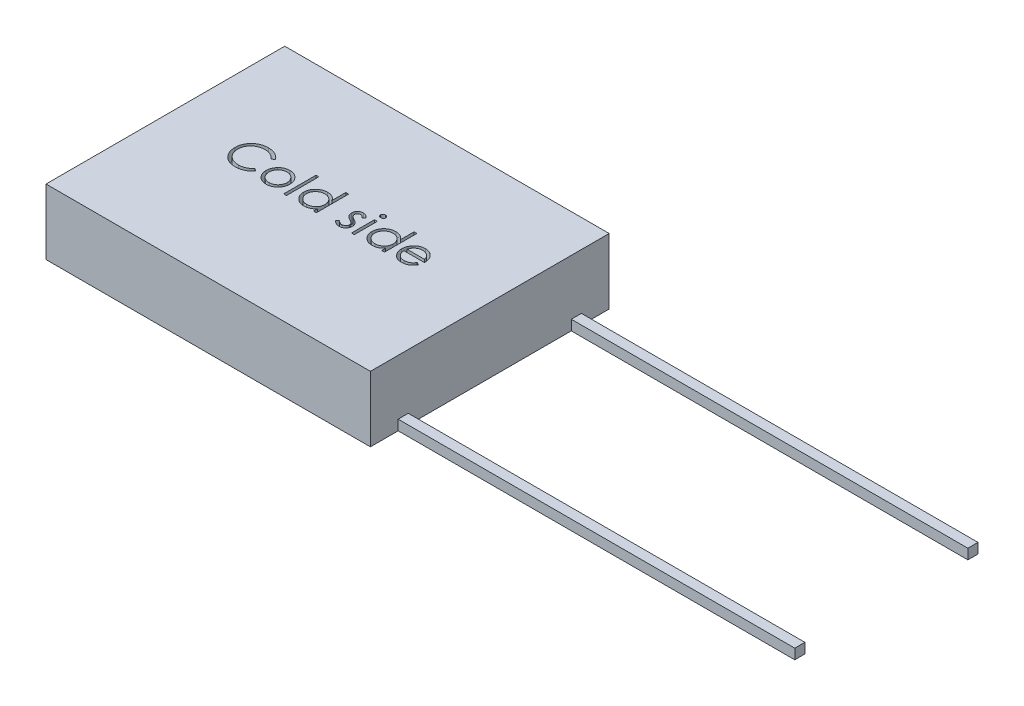
from build123d import *

# Parameters (mm, degrees)
BOSS_EXTRUDE1_DEPTH = 1.65
SKETCH2_3_W         = 10
SKETCH2_3_H         = 0.255
BOSS_EXTRUDE2_DEPTH = 0.255
SKETCH3_W           = 0.071233974
SKETCH3_H           = 0.814102564
SKETCH3_W_2         = 0.071233975
SKETCH3_H_2         = 0.580048077
CUT_EXTRUDE1_DEPTH  = 0.255


with BuildPart() as part:
    # Sketch2 → Boss-Extrude1 (new body)
    with BuildSketch(Plane(origin=(0, 0, 0), x_dir=(1, 0, 0), z_dir=(0, 1, 0))):
        Polygon((0, 6.02), (0, 0), (8.18, 0), (8.18, 0.7), (8.18, 0.955), (8.18, 5.065), (8.18, 5.32), (8.18, 6.02), align=None)
    extrude(amount=BOSS_EXTRUDE1_DEPTH)

    # Sketch2<3> → Boss-Extrude2 (add)
    with BuildSketch(Plane(origin=(0, 0, 0), x_dir=(1, 0, 0), z_dir=(0, 1, 0))):
        with Locations((13.18, 0.8275)):
            Rectangle(SKETCH2_3_W, SKETCH2_3_H)
        with Locations((13.18, 5.1925)):
            Rectangle(SKETCH2_3_W, SKETCH2_3_H)
    extrude(amount=BOSS_EXTRUDE2_DEPTH)

    # Sketch3 → Cut-Extrude1 (cut)
    # profile 1 of 9: a face of its own
    with BuildSketch(Plane(origin=(0, 1.65, 0), x_dir=(1, 0, 0), z_dir=(0, 1, 0))):
        with BuildLine():
            Line((2.356654302, 3.429735273), (2.294324575, 3.382033951))
            add(Edge.make_bspline(
                [(2.294324575, 3.382033951), (2.289878239, 3.387333019), (2.281045515, 3.397859713), (2.266835303, 3.412641502), (2.252025823, 3.426490231), (2.236622737, 3.439471872), (2.220348794, 3.45113246), (2.20359822, 3.462079656), (2.186090806, 3.471892161), (2.161881037, 3.483790017), (2.1302109, 3.496205663), (2.090343142, 3.50661586), (2.048725447, 3.513242805), (2.02033242, 3.513960546), (2.00589058, 3.514325618)],
                knots=[0, 0, 0, 0, 0.757959112, 1.505699292, 2.245454638, 2.979532153, 3.711538275, 4.438200793, 5.171680507, 5.909471876, 7.393775596, 8.890124382, 10.418191784, 12, 12, 12, 12], degree=3))
            add(Edge.make_bspline(
                [(2.00589058, 3.514325618), (1.997934189, 3.514234005), (1.98209525, 3.514051629), (1.958589257, 3.511645631), (1.93552219, 3.508263982), (1.912909054, 3.503246275), (1.890778633, 3.496902484), (1.868986249, 3.489322078), (1.847847416, 3.479943391), (1.827069709, 3.469577411), (1.807162638, 3.457869044), (1.788326939, 3.44509798), (1.770631311, 3.431407131), (1.754061754, 3.416745184), (1.73860133, 3.401178168), (1.724362065, 3.384540183), (1.711393231, 3.366884423), (1.699437763, 3.348443703), (1.688730589, 3.32927174), (1.679765777, 3.309297572), (1.671827116, 3.288863249), (1.665545323, 3.267737896), (1.660573156, 3.246070162), (1.657142418, 3.223801894), (1.654763783, 3.200979613), (1.654582314, 3.185510715), (1.654490841, 3.177713288)],
                knots=[0, 0, 0, 0, 1.054917814, 2.100044995, 3.131103042, 4.146048494, 5.169673617, 6.183595914, 7.203665975, 8.234915748, 9.262203917, 10.264457458, 11.251630812, 12.227803204, 13.197192746, 14.159520551, 15.12972552, 16.100847026, 17.073214652, 18.039054194, 19.002613845, 19.979014051, 20.95965708, 21.949030935, 22.966165397, 24, 24, 24, 24], degree=3))
            add(Edge.make_bspline(
                [(1.654490841, 3.177713288), (1.654777003, 3.165981364), (1.655338846, 3.142947287), (1.660339093, 3.109208237), (1.667937569, 3.076886585), (1.679325744, 3.04618437), (1.6933681, 3.016723011), (1.711111953, 2.989000985), (1.731662489, 2.962599371), (1.755310438, 2.938142131), (1.781256043, 2.915800626), (1.809093516, 2.896126833), (1.838753524, 2.879726851), (1.869908581, 2.866079806), (1.902798432, 2.855589441), (1.937363932, 2.848204363), (1.973529902, 2.84338694), (1.998242605, 2.842925728), (2.010819717, 2.842691002)],
                knots=[0, 0, 0, 0, 1.029171465, 2.020641659, 2.987623507, 3.938342917, 4.889210282, 5.84687017, 6.821220943, 7.821438502, 8.827599549, 9.822697543, 10.807740252, 11.797342354, 12.80366471, 13.83203677, 14.896651826, 16, 16, 16, 16], degree=3))
            add(Edge.make_bspline(
                [(2.010819717, 2.842691002), (2.024676934, 2.843073994), (2.051951252, 2.843827812), (2.091949001, 2.850213927), (2.13023854, 2.860568491), (2.166821931, 2.875059627), (2.201596038, 2.893897647), (2.23461528, 2.916734487), (2.26590753, 2.943787377), (2.284724231, 2.964443729), (2.294324575, 2.974982669)],
                knots=[0, 0, 0, 0, 1.028121516, 2.023589091, 2.998037872, 3.967518031, 4.937445131, 5.927275754, 6.942489185, 8, 8, 8, 8], degree=3))
            Line((2.294324575, 2.974982669), (2.356654302, 2.92775836))
            add(Edge.make_bspline(
                [(2.356654302, 2.92775836), (2.351638231, 2.921286247), (2.341630115, 2.908373022), (2.325424458, 2.890168545), (2.308352642, 2.873045308), (2.290287865, 2.857141365), (2.271437937, 2.842138478), (2.251464395, 2.828462884), (2.230629811, 2.815923701), (2.209004777, 2.804442238), (2.18661227, 2.794255648), (2.163479122, 2.785534883), (2.139705045, 2.778022631), (2.115288953, 2.771842281), (2.090180201, 2.767018303), (2.064469397, 2.763793484), (2.03810105, 2.761584157), (2.020311656, 2.76138279), (2.01129673, 2.761280746)],
                knots=[0, 0, 0, 0, 0.986787822, 1.968848986, 2.935600012, 3.899624008, 4.868462664, 5.837806735, 6.815139263, 7.798259679, 8.787526145, 9.778297419, 10.776456485, 11.791383307, 12.812564526, 13.85620153, 14.913611965, 16, 16, 16, 16], degree=3))
            add(Edge.make_bspline(
                [(2.01129673, 2.761280746), (2.002759684, 2.761340162), (1.985878733, 2.76145765), (1.960955266, 2.763360874), (1.936691558, 2.765957511), (1.913156955, 2.769867326), (1.890223029, 2.774481132), (1.868097682, 2.780665863), (1.846563197, 2.787593978), (1.825706091, 2.795736716), (1.805508623, 2.804925207), (1.786035937, 2.815310079), (1.767296989, 2.826804002), (1.749107546, 2.83915362), (1.731736308, 2.852755615), (1.715032741, 2.867421084), (1.698903179, 2.883100597), (1.688923999, 2.894406966), (1.683906656, 2.900091593)],
                knots=[0, 0, 0, 0, 1.114604814, 2.203992996, 3.262667896, 4.300477797, 5.318619304, 6.316056647, 7.298880507, 8.271930387, 9.238335007, 10.195173496, 11.151986948, 12.108099108, 13.064862484, 14.031167946, 15.010108607, 16, 16, 16, 16], degree=3))
            add(Edge.make_bspline(
                [(1.683906656, 2.900091593), (1.675870358, 2.909966113), (1.659894784, 2.929595938), (1.639455567, 2.961410795), (1.621959603, 2.994627692), (1.607813636, 3.02942114), (1.596754944, 3.065713066), (1.589093852, 3.103521763), (1.584115541, 3.142811921), (1.583546244, 3.169535621), (1.583256866, 3.183119438)],
                knots=[0, 0, 0, 0, 0.994628077, 1.977248131, 2.950237994, 3.925870899, 4.908910175, 5.911660606, 6.938484602, 8, 8, 8, 8], degree=3))
            add(Edge.make_bspline(
                [(1.583256866, 3.183119438), (1.583609562, 3.197396835), (1.584303469, 3.225486724), (1.590198944, 3.26671046), (1.599682849, 3.306205509), (1.613153215, 3.343898144), (1.630231393, 3.379986618), (1.6513285, 3.414195249), (1.676199441, 3.446742808), (1.704649158, 3.47713544), (1.735847464, 3.504925614), (1.769257267, 3.529374521), (1.804813172, 3.549721172), (1.842123471, 3.56672923), (1.881467545, 3.579802171), (1.922761452, 3.588953697), (1.965927599, 3.5946499), (1.995378542, 3.595369992), (2.010342704, 3.595735874)],
                knots=[0, 0, 0, 0, 1.032925535, 2.032216505, 3.007276963, 3.968222605, 4.92396291, 5.891752235, 6.871517503, 7.883894988, 8.900124299, 9.891468569, 10.874487609, 11.85992873, 12.854644235, 13.869047385, 14.917252991, 16, 16, 16, 16], degree=3))
            add(Edge.make_bspline(
                [(2.010342704, 3.595735874), (2.019462772, 3.595626532), (2.037515027, 3.595410101), (2.064219647, 3.593299601), (2.090218889, 3.589781336), (2.115530665, 3.584992513), (2.140278115, 3.579049067), (2.164272099, 3.571306535), (2.187653408, 3.562453608), (2.210274582, 3.55225767), (2.232027085, 3.540812534), (2.252904143, 3.528245062), (2.272739923, 3.514570835), (2.291674002, 3.49990615), (2.309389642, 3.483940763), (2.326389835, 3.467113808), (2.342097258, 3.448940601), (2.351793072, 3.436148768), (2.356654302, 3.429735273)],
                knots=[0, 0, 0, 0, 1.096760587, 2.17092713, 3.219439832, 4.250915756, 5.268269357, 6.278326846, 7.281116186, 8.274029601, 9.260640565, 10.235837813, 11.203064059, 12.156899882, 13.114053108, 14.069676657, 15.032185724, 16, 16, 16, 16], degree=3))
        make_face()
    # profile 2 of 9: a face of its own
    with BuildSketch(Plane(origin=(0, 1.65, 0), x_dir=(1, 0, 0), z_dir=(0, 1, 0))):
        with BuildLine():
            add(Edge.make_bspline(
                [(2.779288016, 3.371857669), (2.790171751, 3.371625919), (2.811512096, 3.371171513), (2.842764956, 3.366314905), (2.872597514, 3.35888827), (2.901124025, 3.348621327), (2.927979149, 3.334859527), (2.953554056, 3.318438135), (2.977778628, 3.298983868), (2.992298136, 3.283934806), (2.999668124, 3.276296021)],
                knots=[0, 0, 0, 0, 1.054011418, 2.066658804, 3.057071809, 4.030435133, 4.997543892, 5.974964718, 6.972108034, 8, 8, 8, 8], degree=3))
            add(Edge.make_bspline(
                [(2.999668124, 3.276296021), (3.006014032, 3.268990349), (3.018583036, 3.25452039), (3.034699726, 3.231058135), (3.048583901, 3.206760291), (3.05971068, 3.181304201), (3.06848389, 3.154912088), (3.074712718, 3.127493239), (3.078417701, 3.099108206), (3.078917303, 3.07983055), (3.079170328, 3.070067305)],
                knots=[0, 0, 0, 0, 1.025258237, 2.030674902, 3.01204498, 3.988269485, 4.97094183, 5.956517959, 6.965070386, 8, 8, 8, 8], degree=3))
            add(Edge.make_bspline(
                [(3.079170328, 3.070067305), (3.078947775, 3.06024747), (3.078507999, 3.040843019), (3.074347929, 3.012263627), (3.067877486, 2.984551587), (3.058617409, 2.957822919), (3.046743337, 2.931995921), (3.032253842, 2.907183398), (3.015047243, 2.883336396), (2.995542765, 2.860657408), (2.973986358, 2.839755427), (2.950601089, 2.821538123), (2.925846513, 2.805930385), (2.899393467, 2.793358197), (2.871483519, 2.783445462), (2.84205647, 2.776483137), (2.811158034, 2.772273612), (2.790060789, 2.771733052), (2.779288016, 2.771457028)],
                knots=[0, 0, 0, 0, 0.998656419, 1.973391657, 2.932242238, 3.890759089, 4.846373663, 5.82037756, 6.809684879, 7.83454468, 8.860553229, 9.859544525, 10.845671541, 11.83227036, 12.833544569, 13.85385346, 14.904124723, 16, 16, 16, 16], degree=3))
            add(Edge.make_bspline(
                [(2.779288016, 2.771457028), (2.768462464, 2.771733978), (2.747260072, 2.772276398), (2.716252573, 2.776466782), (2.686772784, 2.783442253), (2.658826299, 2.793390774), (2.632259521, 2.805930786), (2.607361512, 2.821490937), (2.583957245, 2.83976083), (2.562396277, 2.860655944), (2.542893022, 2.883336773), (2.525686108, 2.9071833), (2.511196695, 2.931995946), (2.499322602, 2.957822912), (2.49006253, 2.984551589), (2.483592086, 3.012263627), (2.479432016, 3.040843019), (2.47899224, 3.06024747), (2.478769687, 3.070067305)],
                knots=[0, 0, 0, 0, 1.099876186, 2.154163076, 3.173186993, 4.173200201, 5.163417411, 6.152872554, 7.150605724, 8.17532212, 9.198891216, 10.186952605, 11.159729845, 12.11414092, 13.071450619, 14.029093627, 15.002601286, 16, 16, 16, 16], degree=3))
            add(Edge.make_bspline(
                [(2.478769687, 3.070067305), (2.479024438, 3.079777486), (2.4795288, 3.099001975), (2.483230059, 3.127333648), (2.489434588, 3.154706091), (2.498218316, 3.180996333), (2.509447654, 3.20634087), (2.523136732, 3.230698751), (2.539417822, 3.254054913), (2.551936836, 3.26850617), (2.558271891, 3.275819007)],
                knots=[0, 0, 0, 0, 1.031353054, 2.041901799, 3.029428768, 4.008703097, 4.981709435, 5.96992636, 6.972712378, 8, 8, 8, 8], degree=3))
            add(Edge.make_bspline(
                [(2.558271891, 3.275819007), (2.565630767, 3.283524038), (2.580103294, 3.298677337), (2.604448452, 3.318074892), (2.629960443, 3.334838001), (2.657112346, 3.348326357), (2.685615423, 3.358948664), (2.715600858, 3.366334058), (2.74695977, 3.371154015), (2.768404541, 3.37162078), (2.779288016, 3.371857669)],
                knots=[0, 0, 0, 0, 1.027980169, 2.021703884, 2.998553061, 3.971491411, 4.943284454, 5.930300938, 6.949603206, 8, 8, 8, 8], degree=3))
        make_face()
        with BuildLine():
            add(Edge.make_bspline(
                [(2.778970007, 3.300623695), (2.771273442, 3.300404939), (2.756078997, 3.299973075), (2.733713484, 3.296688332), (2.712182413, 3.291484166), (2.691444936, 3.284090032), (2.671570984, 3.274542603), (2.652541531, 3.262815886), (2.634300602, 3.249065198), (2.617205027, 3.233312056), (2.601515467, 3.216103784), (2.587799926, 3.197768531), (2.576137447, 3.178603699), (2.566421911, 3.158589358), (2.559185816, 3.137522686), (2.553930506, 3.115642257), (2.550648862, 3.092903493), (2.550221058, 3.077445548), (2.550003661, 3.069590291)],
                knots=[0, 0, 0, 0, 1.021534396, 2.016698045, 2.994645724, 3.958388632, 4.93408049, 5.916473867, 6.921342795, 7.962252576, 8.998418191, 10.008913653, 10.997312074, 11.973003931, 12.956656626, 13.948281152, 14.957379055, 16, 16, 16, 16], degree=3))
            add(Edge.make_bspline(
                [(2.550003661, 3.069590291), (2.550368066, 3.059441171), (2.551091341, 3.039297065), (2.556973082, 3.009630971), (2.566812471, 2.981150801), (2.580099229, 2.954023513), (2.59674671, 2.928924622), (2.616360742, 2.906547338), (2.638730817, 2.887228413), (2.663590273, 2.871199007), (2.690431341, 2.858462777), (2.718837686, 2.849436938), (2.748465129, 2.843569608), (2.768712723, 2.842986434), (2.778970007, 2.842691002)],
                knots=[0, 0, 0, 0, 1.016792936, 2.018143844, 3.017858371, 4.030088057, 5.03801393, 6.028138512, 7.003788237, 7.991172063, 8.984598303, 9.972568034, 10.972917682, 12, 12, 12, 12], degree=3))
            add(Edge.make_bspline(
                [(2.778970007, 2.842691002), (2.789226702, 2.842988155), (2.809473132, 2.843574727), (2.839059409, 2.849407388), (2.867388114, 2.858502325), (2.894201303, 2.871184683), (2.919049444, 2.887289285), (2.941580405, 2.906438249), (2.961026965, 2.92898389), (2.977657979, 2.954056758), (2.99116233, 2.981108745), (3.000955663, 3.009636227), (3.006851544, 3.039295726), (3.007572911, 3.059440722), (3.007936354, 3.069590291)],
                knots=[0, 0, 0, 0, 1.02726834, 2.027799167, 3.010890988, 4.004497153, 4.992059811, 5.971914811, 6.958719428, 7.966827853, 8.981595046, 9.981490638, 10.983022906, 12, 12, 12, 12], degree=3))
            add(Edge.make_bspline(
                [(3.007936354, 3.069590291), (3.007719032, 3.077445595), (3.007291375, 3.092903632), (3.00400866, 3.115641724), (2.998757315, 3.13752464), (2.991506608, 3.158582148), (2.981833287, 3.178655519), (2.969945908, 3.197712261), (2.956286372, 3.216167299), (2.940407489, 3.233256428), (2.923329758, 3.249071339), (2.905081437, 3.262821218), (2.886080201, 3.274491065), (2.866263987, 3.284171695), (2.845523851, 3.291416895), (2.824022948, 3.296718382), (2.801752861, 3.299959194), (2.786612864, 3.300400778), (2.778970007, 3.300623695)],
                knots=[0, 0, 0, 0, 1.042956736, 2.052379634, 3.044323526, 4.02829302, 5.004299113, 5.996692471, 7.007513377, 8.048758398, 9.090003419, 10.095195979, 11.07790575, 12.047570684, 13.018257071, 13.989683339, 14.985167495, 16, 16, 16, 16], degree=3))
        make_face(mode=Mode.SUBTRACT)
    # profile 3 of 9: a face of its own
    with BuildSketch(Plane(origin=(0, 1.65, 0), x_dir=(1, 0, 0), z_dir=(0, 1, 0))):
        with Locations((3.247078982, 3.188684592)):
            Rectangle(SKETCH3_W, SKETCH3_H)
    # profile 4 of 9: a face of its own
    with BuildSketch(Plane(origin=(0, 1.65, 0), x_dir=(1, 0, 0), z_dir=(0, 1, 0))):
        with BuildLine():
            Line((4.035740841, 3.595735874), (4.035740841, 2.78163331))
            Line((4.035740841, 2.78163331), (3.964506866, 2.78163331))
            Line((3.964506866, 2.78163331), (3.964506866, 2.881965091))
            add(Edge.make_bspline(
                [(3.964506866, 2.881965091), (3.956474391, 2.872884683), (3.940798913, 2.855164153), (3.914618517, 2.832013374), (3.886867162, 2.812877577), (3.857679541, 2.797422149), (3.827082011, 2.785812522), (3.795142398, 2.777560661), (3.761847675, 2.772255273), (3.739111873, 2.771725497), (3.7275903, 2.771457028)],
                knots=[0, 0, 0, 0, 1.074387032, 2.096679803, 3.090159297, 4.057316773, 5.018401886, 5.985159533, 6.978961417, 8, 8, 8, 8], degree=3))
            add(Edge.make_bspline(
                [(3.7275903, 2.771457028), (3.717346853, 2.771735152), (3.697146323, 2.772283624), (3.6674308, 2.776538647), (3.638834879, 2.783371841), (3.611331539, 2.792874364), (3.585098748, 2.805479301), (3.559911905, 2.820569905), (3.535901491, 2.838540593), (3.513433481, 2.859084664), (3.492743367, 2.881399241), (3.474586614, 2.905199392), (3.459447969, 2.9303822), (3.446788772, 2.956628826), (3.437037816, 2.984141317), (3.430240224, 3.012824532), (3.425990158, 3.042644557), (3.425441912, 3.062950842), (3.425163918, 3.073247393)],
                knots=[0, 0, 0, 0, 1.033919861, 2.038935746, 3.024066025, 3.998881131, 4.97069526, 5.957263378, 6.95902576, 7.993208707, 9.027059324, 10.027763471, 11.009749337, 11.988697705, 12.965288445, 13.950418724, 14.960734635, 16, 16, 16, 16], degree=3))
            add(Edge.make_bspline(
                [(3.425163918, 3.073247393), (3.425448074, 3.083331125), (3.426009835, 3.103266121), (3.430194762, 3.132584683), (3.437232151, 3.160823646), (3.447108181, 3.187892095), (3.459772338, 3.213822785), (3.475177458, 3.238634055), (3.493324652, 3.262394258), (3.51424618, 3.284544697), (3.536909959, 3.305005443), (3.561155332, 3.322787495), (3.586379183, 3.338144709), (3.612972758, 3.350312551), (3.640542441, 3.360157115), (3.669333669, 3.366968163), (3.699226652, 3.370981663), (3.719521817, 3.371562861), (3.729816362, 3.371857669)],
                knots=[0, 0, 0, 0, 1.020392517, 2.01726096, 2.990465484, 3.961182959, 4.928053699, 5.906110375, 6.912531644, 7.948652711, 8.985773172, 9.998621852, 10.987621588, 11.969261332, 12.953316658, 13.946091881, 14.958173133, 16, 16, 16, 16], degree=3))
            add(Edge.make_bspline(
                [(3.729816362, 3.371857669), (3.741658388, 3.371502274), (3.764902969, 3.370804673), (3.798897812, 3.364974836), (3.831053217, 3.355186112), (3.861554305, 3.341785054), (3.890219239, 3.324367741), (3.917258138, 3.303333037), (3.942200784, 3.278085631), (3.956958144, 3.259123721), (3.964506866, 3.249424276)],
                knots=[0, 0, 0, 0, 1.031072012, 2.023879775, 2.993683497, 3.952812103, 4.918022106, 5.908088563, 6.929940113, 8, 8, 8, 8], degree=3))
            Line((3.964506866, 3.249424276), (3.964506866, 3.595735874))
            Line((3.964506866, 3.595735874), (4.035740841, 3.595735874))
        make_face()
        with BuildLine():
            add(Edge.make_bspline(
                [(3.730770388, 3.300623695), (3.720357672, 3.300253209), (3.699804627, 3.299521929), (3.669632148, 3.29381294), (3.640759285, 3.284314113), (3.613330443, 3.271323396), (3.587778901, 3.254988307), (3.564943015, 3.235230422), (3.544636009, 3.212588813), (3.527557171, 3.187165656), (3.513634683, 3.159910982), (3.503845017, 3.131421154), (3.497388598, 3.102210025), (3.496728987, 3.082397416), (3.496397892, 3.072452371)],
                knots=[0, 0, 0, 0, 1.031046209, 2.035121221, 3.029706178, 4.034933723, 5.034054252, 6.02443088, 7.017295772, 8.038157696, 9.050218397, 10.03989886, 11.016116709, 12, 12, 12, 12], degree=3))
            add(Edge.make_bspline(
                [(3.496397892, 3.072452371), (3.496820823, 3.062566757), (3.497665028, 3.042834278), (3.503731703, 3.013583326), (3.513909817, 2.985086784), (3.527798642, 2.957586523), (3.545190073, 2.932054058), (3.56534875, 2.908980851), (3.588469617, 2.889139462), (3.614079963, 2.872530227), (3.641432127, 2.859113012), (3.670196251, 2.849777234), (3.699831619, 2.843749773), (3.719982059, 2.843045722), (3.73013437, 2.842691002)],
                knots=[0, 0, 0, 0, 0.979072187, 1.954306742, 2.945804271, 3.96968567, 4.997920485, 5.998718438, 6.996577872, 8.005894225, 9.015743152, 10.005417472, 10.995077863, 12, 12, 12, 12], degree=3))
            add(Edge.make_bspline(
                [(3.73013437, 2.842691002), (3.740440988, 2.843067459), (3.760939828, 2.843816192), (3.791201821, 2.849549622), (3.820569429, 2.859022189), (3.848642604, 2.872152884), (3.874794655, 2.888426427), (3.898266495, 2.907478035), (3.918113866, 2.929635722), (3.93493969, 2.953987167), (3.948133044, 2.980682566), (3.957743328, 3.00910657), (3.963425196, 3.039260169), (3.964141324, 3.059866809), (3.964506866, 3.070385313)],
                knots=[0, 0, 0, 0, 1.01762866, 2.023962475, 3.030623092, 4.058876274, 5.077231937, 6.066672613, 7.034107872, 8.005628644, 8.981990164, 9.965428785, 10.961468474, 12, 12, 12, 12], degree=3))
            add(Edge.make_bspline(
                [(3.964506866, 3.070385313), (3.96428923, 3.078399429), (3.963860853, 3.094173743), (3.960588206, 3.117334805), (3.955382356, 3.139499418), (3.948046707, 3.160690885), (3.938410291, 3.18079204), (3.92678803, 3.199947215), (3.912975544, 3.218056782), (3.897195182, 3.234871371), (3.879922003, 3.250208087), (3.861644312, 3.263897834), (3.842145561, 3.27514386), (3.821753661, 3.284451434), (3.800433233, 3.291858062), (3.778010789, 3.2967992), (3.754724662, 3.300191987), (3.738839217, 3.300478277), (3.730770388, 3.300623695)],
                knots=[0, 0, 0, 0, 1.050140795, 2.067009409, 3.05949893, 4.030605086, 5.00011959, 5.97591094, 6.962425594, 7.979863591, 8.993523472, 9.986985069, 10.967611495, 11.937549037, 12.921786183, 13.919465291, 14.943216303, 16, 16, 16, 16], degree=3))
        make_face(mode=Mode.SUBTRACT)
    # profile 5 of 9: a face of its own
    with BuildSketch(Plane(origin=(0, 1.65, 0), x_dir=(1, 0, 0), z_dir=(0, 1, 0))):
        with BuildLine():
            Line((4.778609431, 3.289334382), (4.730272091, 3.239566002))
            add(Edge.make_bspline(
                [(4.730272091, 3.239566002), (4.726101387, 3.24439952), (4.718060762, 3.253717972), (4.705308265, 3.266176913), (4.692602912, 3.276640112), (4.680118628, 3.285473928), (4.667541485, 3.292152574), (4.655019077, 3.297027301), (4.642538438, 3.300043961), (4.63419589, 3.300432771), (4.630099314, 3.300623695)],
                knots=[0, 0, 0, 0, 1.26578478, 2.440284043, 3.530471711, 4.527705817, 5.468200915, 6.346673037, 7.188140097, 8, 8, 8, 8], degree=3))
            add(Edge.make_bspline(
                [(4.630099314, 3.300623695), (4.625078417, 3.300379929), (4.615198002, 3.299900232), (4.601040718, 3.295112008), (4.587898344, 3.287762169), (4.576523457, 3.277337151), (4.566887859, 3.265370969), (4.559854399, 3.251991445), (4.555553185, 3.237602335), (4.555007826, 3.227616992), (4.554731225, 3.222552531)],
                knots=[0, 0, 0, 0, 0.99966794, 1.967205029, 2.953328237, 3.988086729, 5.028030931, 6.008226631, 6.989793394, 8, 8, 8, 8], degree=3))
            add(Edge.make_bspline(
                [(4.554731225, 3.222552531), (4.554983142, 3.217968728), (4.555486264, 3.208814044), (4.559397565, 3.195309401), (4.565626478, 3.182142894), (4.571448111, 3.174077735), (4.574447772, 3.169922072)],
                knots=[0, 0, 0, 0, 0.960159726, 1.917612774, 2.927026955, 4, 4, 4, 4], degree=3))
            add(Edge.make_bspline(
                [(4.574447772, 3.169922072), (4.576253779, 3.167703068), (4.580097636, 3.162980198), (4.587311353, 3.156425217), (4.595480742, 3.149181171), (4.605305085, 3.141938352), (4.616361122, 3.134311158), (4.628888602, 3.12659996), (4.642489963, 3.118216956), (4.652227531, 3.112900093), (4.657289068, 3.110136415)],
                knots=[0, 0, 0, 0, 0.66740084, 1.420478572, 2.27185888, 3.217733974, 4.268547843, 5.408967954, 6.65319498, 8, 8, 8, 8], degree=3))
            add(Edge.make_bspline(
                [(4.657289068, 3.110136415), (4.663460719, 3.106679089), (4.675382315, 3.100000673), (4.692321568, 3.089634365), (4.7076947, 3.079331167), (4.721631968, 3.069201268), (4.733865199, 3.058961243), (4.744765553, 3.04900359), (4.754061147, 3.039027444), (4.759266769, 3.032057613), (4.761754963, 3.028726159)],
                knots=[0, 0, 0, 0, 1.27191281, 2.456916733, 3.569705269, 4.599008579, 5.553216877, 6.436649441, 7.252746552, 8, 8, 8, 8], degree=3))
            add(Edge.make_bspline(
                [(4.761754963, 3.028726159), (4.765884851, 3.021998314), (4.774104093, 3.008608654), (4.782735165, 2.986560903), (4.78773812, 2.963176914), (4.788432588, 2.947181214), (4.788785713, 2.939047673)],
                knots=[0, 0, 0, 0, 0.995354457, 1.980940102, 2.973342416, 4, 4, 4, 4], degree=3))
            add(Edge.make_bspline(
                [(4.788785713, 2.939047673), (4.788622533, 2.933316992), (4.788300969, 2.922024058), (4.7860653, 2.905392766), (4.782220153, 2.889487251), (4.77698282, 2.874134927), (4.76991065, 2.859629953), (4.761622131, 2.845606375), (4.751671928, 2.832367548), (4.74031192, 2.819930856), (4.727873745, 2.808572124), (4.714605389, 2.79858812), (4.700490511, 2.790293583), (4.685629969, 2.783429835), (4.669989997, 2.777971497), (4.653568151, 2.774192673), (4.63641663, 2.771930994), (4.624753084, 2.771617014), (4.618810001, 2.771457028)],
                knots=[0, 0, 0, 0, 1.032770009, 2.035186124, 3.017557409, 3.978232242, 4.952395191, 5.920591857, 6.910227898, 7.931268572, 8.952309245, 9.941945286, 10.918353717, 11.897095711, 12.887975737, 13.898235213, 14.929059601, 16, 16, 16, 16], degree=3))
            add(Edge.make_bspline(
                [(4.618810001, 2.771457028), (4.610789231, 2.771682158), (4.594859139, 2.772129291), (4.571298435, 2.776326201), (4.548274977, 2.782856585), (4.525962996, 2.791863592), (4.504861466, 2.803237057), (4.485554989, 2.81685835), (4.467976496, 2.83227751), (4.457971102, 2.844095973), (4.452968405, 2.850005205)],
                knots=[0, 0, 0, 0, 1.013940152, 2.01379169, 3.017749504, 4.037548394, 5.051665909, 6.043208538, 7.021604269, 8, 8, 8, 8], degree=3))
            Line((4.452968405, 2.850005205), (4.500192714, 2.903748695))
            add(Edge.make_bspline(
                [(4.500192714, 2.903748695), (4.504676815, 2.898905739), (4.513369922, 2.889516938), (4.527272162, 2.877015525), (4.541418919, 2.866537736), (4.555668929, 2.857773962), (4.570233129, 2.851021326), (4.585029902, 2.846277288), (4.600029152, 2.843228337), (4.610103457, 2.842870405), (4.6151529, 2.842691002)],
                knots=[0, 0, 0, 0, 1.179806542, 2.287233372, 3.337373186, 4.324005949, 5.273901747, 6.200048787, 7.097828587, 8, 8, 8, 8], degree=3))
            add(Edge.make_bspline(
                [(4.6151529, 2.842691002), (4.622028573, 2.843001886), (4.635462483, 2.8436093), (4.654703836, 2.849124069), (4.672469917, 2.857771398), (4.68789664, 2.870037035), (4.701028023, 2.884314459), (4.710536734, 2.900396768), (4.716495795, 2.917811974), (4.717195656, 2.929884299), (4.717551738, 2.936026589)],
                knots=[0, 0, 0, 0, 1.072336372, 2.095165389, 3.102688358, 4.141489647, 5.156069229, 6.117746104, 7.042326257, 8, 8, 8, 8], degree=3))
            add(Edge.make_bspline(
                [(4.717551738, 2.936026589), (4.717305382, 2.941086092), (4.716818985, 2.951075403), (4.712999172, 2.96553307), (4.706963757, 2.979246639), (4.701020917, 2.987272505), (4.697994196, 2.991360123)],
                knots=[0, 0, 0, 0, 1.013901739, 2.00181326, 2.98231254, 4, 4, 4, 4], degree=3))
            add(Edge.make_bspline(
                [(4.697994196, 2.991360123), (4.696174832, 2.993409214), (4.692211599, 2.997872875), (4.684941928, 3.004319276), (4.67623747, 3.01126756), (4.666000326, 3.018599902), (4.654209859, 3.026219586), (4.640818281, 3.034086635), (4.626009049, 3.042574709), (4.615538209, 3.048203452), (4.610064759, 3.05114578)],
                knots=[0, 0, 0, 0, 0.615000592, 1.339693406, 2.178160186, 3.116406724, 4.166410947, 5.330106347, 6.604359322, 8, 8, 8, 8], degree=3))
            add(Edge.make_bspline(
                [(4.610064759, 3.05114578), (4.604157753, 3.054443047), (4.592702184, 3.060837501), (4.57647628, 3.070797041), (4.561837862, 3.080926941), (4.548434696, 3.09065896), (4.536605325, 3.100506209), (4.526396351, 3.110479622), (4.517405836, 3.120176976), (4.512428477, 3.12704797), (4.510050987, 3.130329975)],
                knots=[0, 0, 0, 0, 1.262093308, 2.447601706, 3.550203992, 4.582594899, 5.537233252, 6.418365656, 7.244515135, 8, 8, 8, 8], degree=3))
            add(Edge.make_bspline(
                [(4.510050987, 3.130329975), (4.505939226, 3.136939784), (4.497714267, 3.150161712), (4.489727965, 3.172230338), (4.484238383, 3.195463414), (4.483747984, 3.211494182), (4.483497251, 3.219690452)],
                knots=[0, 0, 0, 0, 0.985009483, 1.970363186, 2.962279964, 4, 4, 4, 4], degree=3))
            add(Edge.make_bspline(
                [(4.483497251, 3.219690452), (4.483618399, 3.225048354), (4.483855502, 3.235534529), (4.485747814, 3.250942083), (4.489193077, 3.265580682), (4.493514461, 3.279670167), (4.499520429, 3.292937606), (4.506697268, 3.305559926), (4.515130845, 3.317519679), (4.524847091, 3.328632889), (4.535530205, 3.338726968), (4.547072412, 3.347525943), (4.559214123, 3.355033991), (4.572006747, 3.361330733), (4.585573176, 3.366093546), (4.599818581, 3.369372275), (4.614714129, 3.371561937), (4.624897063, 3.371757672), (4.630099314, 3.371857669)],
                knots=[0, 0, 0, 0, 1.087655834, 2.128696564, 3.144119009, 4.137814668, 5.115653402, 6.093965665, 7.082169637, 8.081268856, 9.086088321, 10.061021666, 11.022561449, 11.980240094, 12.950172527, 13.934149372, 14.944599409, 16, 16, 16, 16], degree=3))
            add(Edge.make_bspline(
                [(4.630099314, 3.371857669), (4.636266086, 3.37160722), (4.648715311, 3.371101625), (4.667392164, 3.367086227), (4.686041511, 3.360479255), (4.704711271, 3.351354252), (4.723264676, 3.339546229), (4.741864927, 3.325274763), (4.76073532, 3.308633745), (4.772518269, 3.295911242), (4.778609431, 3.289334382)],
                knots=[0, 0, 0, 0, 0.845714091, 1.707292901, 2.609013841, 3.555613372, 4.552488639, 5.621697636, 6.770543573, 8, 8, 8, 8], degree=3))
        make_face()
    # profile 6 of 9: a face of its own
    with BuildSketch(Plane(origin=(0, 1.65, 0), x_dir=(1, 0, 0), z_dir=(0, 1, 0))):
        with BuildLine():
            add(Edge.make_bspline(
                [(4.956376358, 3.605912156), (4.96079671, 3.605707107), (4.969452608, 3.605305582), (4.981969652, 3.601867176), (4.993367225, 3.596038855), (5.003476818, 3.588219355), (5.012151799, 3.579023321), (5.018225282, 3.568305209), (5.022128807, 3.556725839), (5.022600194, 3.548648845), (5.0228402, 3.544536455)],
                knots=[0, 0, 0, 0, 1.055194115, 2.066272739, 3.074728998, 4.095836921, 5.109056067, 6.073838105, 7.019297344, 8, 8, 8, 8], degree=3))
            add(Edge.make_bspline(
                [(5.0228402, 3.544536455), (5.022594781, 3.540530818), (5.022109618, 3.532612147), (5.018228297, 3.52123352), (5.012100039, 3.510664334), (5.003482381, 3.501486155), (4.993365751, 3.493670979), (4.981970044, 3.487841511), (4.969452505, 3.484403409), (4.960796675, 3.484001842), (4.956376358, 3.483796772)],
                knots=[0, 0, 0, 0, 0.96129708, 1.900370562, 2.859976407, 3.87933698, 4.906634145, 5.921202961, 6.938410037, 8, 8, 8, 8], degree=3))
            add(Edge.make_bspline(
                [(4.956376358, 3.483796772), (4.952006588, 3.483994012), (4.943501403, 3.484377914), (4.931171779, 3.487908972), (4.91987139, 3.493672974), (4.90974208, 3.501434984), (4.901298804, 3.510720701), (4.895153291, 3.52122707), (4.891280934, 3.532613789), (4.890794563, 3.540531369), (4.890548533, 3.544536455)],
                knots=[0, 0, 0, 0, 1.054934014, 2.053291228, 3.073705704, 4.106921865, 5.123545215, 6.088680038, 7.033164197, 8, 8, 8, 8], degree=3))
            add(Edge.make_bspline(
                [(4.890548533, 3.544536455), (4.890789172, 3.548648273), (4.891261803, 3.556724142), (4.895156194, 3.568311766), (4.901247614, 3.578966499), (4.909747671, 3.588270496), (4.919869902, 3.596036872), (4.931172164, 3.601799719), (4.943501301, 3.605331077), (4.952006554, 3.605714937), (4.956376358, 3.605912156)],
                knots=[0, 0, 0, 0, 0.98631895, 1.937192651, 2.907499808, 3.917963147, 4.944918757, 5.95915025, 6.951458133, 8, 8, 8, 8], degree=3))
        make_face()
    # profile 7 of 9: a face of its own
    with BuildSketch(Plane(origin=(0, 1.65, 0), x_dir=(1, 0, 0), z_dir=(0, 1, 0))):
        with Locations((4.956694367, 3.071657349)):
            Rectangle(SKETCH3_W_2, SKETCH3_H_2)
    # profile 8 of 9: a face of its own
    with BuildSketch(Plane(origin=(0, 1.65, 0), x_dir=(1, 0, 0), z_dir=(0, 1, 0))):
        with BuildLine():
            Line((5.755532507, 3.595735874), (5.755532507, 2.78163331))
            Line((5.755532507, 2.78163331), (5.684298533, 2.78163331))
            Line((5.684298533, 2.78163331), (5.684298533, 2.881965091))
            add(Edge.make_bspline(
                [(5.684298533, 2.881965091), (5.676266057, 2.872884683), (5.66059058, 2.855164153), (5.634410184, 2.832013374), (5.606658829, 2.812877577), (5.577471208, 2.797422149), (5.546873678, 2.785812522), (5.514934065, 2.777560661), (5.481639341, 2.772255273), (5.458903539, 2.771725497), (5.447381967, 2.771457028)],
                knots=[0, 0, 0, 0, 1.074387032, 2.096679803, 3.090159297, 4.057316773, 5.018401886, 5.985159533, 6.978961417, 8, 8, 8, 8], degree=3))
            add(Edge.make_bspline(
                [(5.447381967, 2.771457028), (5.43713852, 2.771735152), (5.41693799, 2.772283624), (5.387222467, 2.776538647), (5.358626546, 2.783371841), (5.331123205, 2.792874364), (5.304890415, 2.805479301), (5.279703572, 2.820569905), (5.255693158, 2.838540593), (5.233225148, 2.859084664), (5.212535034, 2.881399241), (5.194378281, 2.905199392), (5.179239636, 2.9303822), (5.166580439, 2.956628826), (5.156829482, 2.984141317), (5.15003189, 3.012824532), (5.145781825, 3.042644557), (5.145233579, 3.062950842), (5.144955584, 3.073247393)],
                knots=[0, 0, 0, 0, 1.033919861, 2.038935746, 3.024066025, 3.998881131, 4.97069526, 5.957263378, 6.95902576, 7.993208707, 9.027059324, 10.027763471, 11.009749337, 11.988697705, 12.965288445, 13.950418724, 14.960734635, 16, 16, 16, 16], degree=3))
            add(Edge.make_bspline(
                [(5.144955584, 3.073247393), (5.14523974, 3.083331125), (5.145801502, 3.103266121), (5.149986428, 3.132584683), (5.157023818, 3.160823646), (5.166899847, 3.187892095), (5.179564005, 3.213822785), (5.194969125, 3.238634055), (5.213116319, 3.262394258), (5.234037847, 3.284544697), (5.256701625, 3.305005443), (5.280946998, 3.322787495), (5.30617085, 3.338144709), (5.332764425, 3.350312551), (5.360334108, 3.360157115), (5.389125336, 3.366968163), (5.419018319, 3.370981663), (5.439313484, 3.371562861), (5.449608028, 3.371857669)],
                knots=[0, 0, 0, 0, 1.020392517, 2.01726096, 2.990465484, 3.961182959, 4.928053699, 5.906110375, 6.912531644, 7.948652711, 8.985773172, 9.998621852, 10.987621588, 11.969261332, 12.953316658, 13.946091881, 14.958173133, 16, 16, 16, 16], degree=3))
            add(Edge.make_bspline(
                [(5.449608028, 3.371857669), (5.461450054, 3.371502274), (5.484694635, 3.370804673), (5.518689479, 3.364974836), (5.550844883, 3.355186112), (5.581345971, 3.341785054), (5.610010906, 3.324367741), (5.637049805, 3.303333037), (5.661992451, 3.278085631), (5.676749811, 3.259123721), (5.684298533, 3.249424276)],
                knots=[0, 0, 0, 0, 1.031072012, 2.023879775, 2.993683497, 3.952812103, 4.918022106, 5.908088563, 6.929940113, 8, 8, 8, 8], degree=3))
            Line((5.684298533, 3.249424276), (5.684298533, 3.595735874))
            Line((5.684298533, 3.595735874), (5.755532507, 3.595735874))
        make_face()
        with BuildLine():
            add(Edge.make_bspline(
                [(5.450562055, 3.300623695), (5.440149339, 3.300253209), (5.419596294, 3.299521929), (5.389423815, 3.29381294), (5.360550951, 3.284314113), (5.333122109, 3.271323396), (5.307570567, 3.254988307), (5.284734681, 3.235230422), (5.264427676, 3.212588813), (5.247348837, 3.187165656), (5.23342635, 3.159910982), (5.223636684, 3.131421154), (5.217180265, 3.102210025), (5.216520654, 3.082397416), (5.216189559, 3.072452371)],
                knots=[0, 0, 0, 0, 1.031046209, 2.035121221, 3.029706178, 4.034933723, 5.034054252, 6.02443088, 7.017295772, 8.038157696, 9.050218397, 10.03989886, 11.016116709, 12, 12, 12, 12], degree=3))
            add(Edge.make_bspline(
                [(5.216189559, 3.072452371), (5.21661249, 3.062566757), (5.217456695, 3.042834278), (5.22352337, 3.013583326), (5.233701484, 2.985086784), (5.247590309, 2.957586523), (5.26498174, 2.932054058), (5.285140416, 2.908980851), (5.308261284, 2.889139462), (5.333871629, 2.872530227), (5.361223794, 2.859113012), (5.389987918, 2.849777234), (5.419623286, 2.843749773), (5.439773726, 2.843045722), (5.449926037, 2.842691002)],
                knots=[0, 0, 0, 0, 0.979072187, 1.954306742, 2.945804271, 3.96968567, 4.997920485, 5.998718438, 6.996577872, 8.005894225, 9.015743152, 10.005417472, 10.995077863, 12, 12, 12, 12], degree=3))
            add(Edge.make_bspline(
                [(5.449926037, 2.842691002), (5.460232655, 2.843067459), (5.480731495, 2.843816192), (5.510993488, 2.849549622), (5.540361095, 2.859022189), (5.56843427, 2.872152884), (5.594586321, 2.888426427), (5.618058161, 2.907478035), (5.637905533, 2.929635722), (5.654731357, 2.953987167), (5.66792471, 2.980682566), (5.677534995, 3.00910657), (5.683216863, 3.039260169), (5.683932991, 3.059866809), (5.684298533, 3.070385313)],
                knots=[0, 0, 0, 0, 1.01762866, 2.023962475, 3.030623092, 4.058876274, 5.077231937, 6.066672613, 7.034107872, 8.005628644, 8.981990164, 9.965428785, 10.961468474, 12, 12, 12, 12], degree=3))
            add(Edge.make_bspline(
                [(5.684298533, 3.070385313), (5.684080897, 3.078399429), (5.68365252, 3.094173743), (5.680379873, 3.117334805), (5.675174023, 3.139499418), (5.667838374, 3.160690885), (5.658201958, 3.18079204), (5.646579696, 3.199947215), (5.63276721, 3.218056782), (5.616986849, 3.234871371), (5.599713669, 3.250208087), (5.581435979, 3.263897834), (5.561937227, 3.27514386), (5.541545328, 3.284451434), (5.5202249, 3.291858062), (5.497802456, 3.2967992), (5.474516329, 3.300191987), (5.458630884, 3.300478277), (5.450562055, 3.300623695)],
                knots=[0, 0, 0, 0, 1.050140795, 2.067009409, 3.05949893, 4.030605086, 5.00011959, 5.97591094, 6.962425594, 7.979863591, 8.993523472, 9.986985069, 10.967611495, 11.937549037, 12.921786183, 13.919465291, 14.943216303, 16, 16, 16, 16], degree=3))
        make_face(mode=Mode.SUBTRACT)
    # profile 9 of 9: a face of its own
    with BuildSketch(Plane(origin=(0, 1.65, 0), x_dir=(1, 0, 0), z_dir=(0, 1, 0))):
        with BuildLine():
            Line((6.394412215, 2.964806387), (6.457695969, 2.931574466))
            add(Edge.make_bspline(
                [(6.457695969, 2.931574466), (6.452653027, 2.922629282), (6.442841459, 2.905225496), (6.425968432, 2.881315056), (6.408280944, 2.859804949), (6.38898058, 2.841269831), (6.368644778, 2.825111035), (6.347160765, 2.810973707), (6.324416694, 2.798927185), (6.300411488, 2.788777951), (6.274943554, 2.78097437), (6.247951175, 2.77546252), (6.219382639, 2.772055457), (6.199800559, 2.771659684), (6.189773543, 2.771457028)],
                knots=[0, 0, 0, 0, 1.120438281, 2.179929193, 3.190490725, 4.156257408, 5.095198341, 6.022838206, 6.959905092, 7.901321166, 8.864066838, 9.862729781, 10.905609505, 12, 12, 12, 12], degree=3))
            add(Edge.make_bspline(
                [(6.189773543, 2.771457028), (6.178628845, 2.771717191), (6.156888767, 2.772224694), (6.125243145, 2.776599949), (6.09544817, 2.78373743), (6.067505516, 2.793708187), (6.041483612, 2.806731884), (6.01733074, 2.822597695), (5.994919883, 2.841224117), (5.97495725, 2.862772489), (5.956985869, 2.885832504), (5.941127692, 2.909861785), (5.927870382, 2.934799874), (5.917086129, 2.96048801), (5.908376455, 2.986764286), (5.902306149, 3.01386778), (5.898806902, 3.041725135), (5.89827068, 3.060570424), (5.898000456, 3.070067305)],
                knots=[0, 0, 0, 0, 1.145258523, 2.234067595, 3.276747158, 4.290159414, 5.277019952, 6.260822364, 7.254936242, 8.264827045, 9.274100331, 10.257902744, 11.220704747, 12.172965371, 13.118907548, 14.062713208, 15.023725156, 16, 16, 16, 16], degree=3))
            add(Edge.make_bspline(
                [(5.898000456, 3.070067305), (5.898240654, 3.078978811), (5.898716695, 3.096640239), (5.901717249, 3.122780818), (5.907034987, 3.148187271), (5.914332117, 3.172880708), (5.923755346, 3.196819785), (5.935283368, 3.220019071), (5.948934139, 3.242453879), (5.959473477, 3.256606018), (5.964782307, 3.263734672)],
                knots=[0, 0, 0, 0, 1.024358464, 2.0301432, 3.019427413, 4.004406732, 4.986367066, 5.972626655, 6.978780325, 8, 8, 8, 8], degree=3))
            add(Edge.make_bspline(
                [(5.964782307, 3.263734672), (5.971973157, 3.272322791), (5.986127068, 3.289226979), (6.010065741, 3.311437992), (6.035987393, 3.330044348), (6.063567172, 3.345467395), (6.093125623, 3.35718624), (6.124265408, 3.36591921), (6.157341104, 3.370812794), (6.179952824, 3.371503999), (6.191522592, 3.371857669)],
                knots=[0, 0, 0, 0, 1.030682036, 2.02871468, 2.997146059, 3.962720338, 4.930598197, 5.918074684, 6.934738563, 8, 8, 8, 8], degree=3))
            add(Edge.make_bspline(
                [(6.191522592, 3.371857669), (6.203416959, 3.37155059), (6.226750997, 3.370948171), (6.260776139, 3.365363271), (6.292970801, 3.356506709), (6.323322101, 3.343998617), (6.351833116, 3.327860648), (6.378318524, 3.307871337), (6.403231278, 3.284644378), (6.41772483, 3.266782007), (6.425100066, 3.257692505)],
                knots=[0, 0, 0, 0, 1.056321875, 2.072262726, 3.055038591, 4.01806755, 4.982017516, 5.957941055, 6.960871419, 8, 8, 8, 8], degree=3))
            add(Edge.make_bspline(
                [(6.425100066, 3.257692505), (6.430118139, 3.250842764), (6.440120884, 3.237188876), (6.452650137, 3.21492506), (6.463526189, 3.191631765), (6.472219557, 3.166932465), (6.479258873, 3.141119811), (6.484351759, 3.114009269), (6.48733844, 3.085608914), (6.487925519, 3.066258071), (6.488224815, 3.056392926)],
                knots=[0, 0, 0, 0, 0.94817472, 1.890038105, 2.849395472, 3.817997239, 4.812318967, 5.836947057, 6.897266129, 8, 8, 8, 8], degree=3))
            Line((6.488224815, 3.056392926), (5.969234431, 3.056392926))
            add(Edge.make_bspline(
                [(5.969234431, 3.056392926), (5.969583591, 3.048750142), (5.970270202, 3.033720915), (5.973471315, 3.011729327), (5.978517019, 2.990780373), (5.985608395, 2.971031183), (5.994196055, 2.952223815), (6.004715673, 2.934497781), (6.017265893, 2.917933822), (6.0312644, 2.902383775), (6.046846188, 2.888536067), (6.063238882, 2.876141824), (6.080677244, 2.86575377), (6.099023774, 2.857321902), (6.118248804, 2.850721005), (6.138358391, 2.846215267), (6.159312964, 2.843197405), (6.173597228, 2.842861838), (6.180869296, 2.842691002)],
                knots=[0, 0, 0, 0, 1.094153842, 2.151609401, 3.174256925, 4.172055639, 5.149267565, 6.128595816, 7.11444997, 8.118368179, 9.117203808, 10.09244225, 11.054858984, 12.015122123, 12.976791628, 13.957293641, 14.960065497, 16, 16, 16, 16], degree=3))
            add(Edge.make_bspline(
                [(6.180869296, 2.842691002), (6.187979289, 2.842828901), (6.202086878, 2.843102518), (6.223096501, 2.845763148), (6.243765643, 2.850065336), (6.264008759, 2.855936815), (6.283415005, 2.863097994), (6.301386763, 2.871739178), (6.317914955, 2.881298139), (6.33336291, 2.892231404), (6.348346867, 2.905613618), (6.363210967, 2.922313148), (6.379148708, 2.942063355), (6.389124919, 2.956928176), (6.394412215, 2.964806387)],
                knots=[0, 0, 0, 0, 0.99110716, 1.966546729, 2.947904876, 3.932708344, 4.903319531, 5.828989031, 6.710028674, 7.56322171, 8.463672341, 9.504779593, 10.677557249, 12, 12, 12, 12], degree=3))
        make_face()
        with BuildLine():
            add(Edge.make_bspline(
                [(6.416990841, 3.1276269), (6.414383571, 3.137075444), (6.409365415, 3.155260851), (6.398879668, 3.180443339), (6.387070586, 3.202824345), (6.373095658, 3.222232583), (6.357261768, 3.239469094), (6.338972593, 3.254531881), (6.318463024, 3.26800691), (6.295839076, 3.27938078), (6.271881029, 3.28906223), (6.246797124, 3.295553997), (6.22120259, 3.300001162), (6.203891065, 3.300415297), (6.195179693, 3.300623695)],
                knots=[0, 0, 0, 0, 1.154881502, 2.222775134, 3.210006277, 4.132804581, 5.035138423, 5.962687519, 6.919655026, 7.923214229, 8.944639381, 9.960483929, 10.97369054, 12, 12, 12, 12], degree=3))
            add(Edge.make_bspline(
                [(6.195179693, 3.300623695), (6.188070088, 3.300484976), (6.174015894, 3.300210759), (6.153310116, 3.297609498), (6.133425613, 3.293309676), (6.114215664, 3.287421195), (6.095932003, 3.279572458), (6.078198546, 3.270368762), (6.061466206, 3.259133439), (6.05100202, 3.25057027), (6.04571555, 3.246244188)],
                knots=[0, 0, 0, 0, 1.04873581, 2.073130211, 3.073294108, 4.04793562, 5.032784715, 6.005352987, 6.992311501, 8, 8, 8, 8], degree=3))
            add(Edge.make_bspline(
                [(6.04571555, 3.246244188), (6.041929752, 3.242821012), (6.03426822, 3.23589334), (6.024030995, 3.223957788), (6.014229209, 3.211087344), (6.005308899, 3.196789611), (5.997127017, 3.181227398), (5.989470737, 3.16453197), (5.982579533, 3.146576636), (5.978702379, 3.134064315), (5.976707638, 3.1276269)],
                knots=[0, 0, 0, 0, 0.879870761, 1.780643979, 2.707998968, 3.669668524, 4.684282772, 5.740141944, 6.837334558, 8, 8, 8, 8], degree=3))
            Line((5.976707638, 3.1276269), (6.416990841, 3.1276269))
        make_face(mode=Mode.SUBTRACT)
    extrude(amount=-CUT_EXTRUDE1_DEPTH, mode=Mode.SUBTRACT)


solid = part.part
